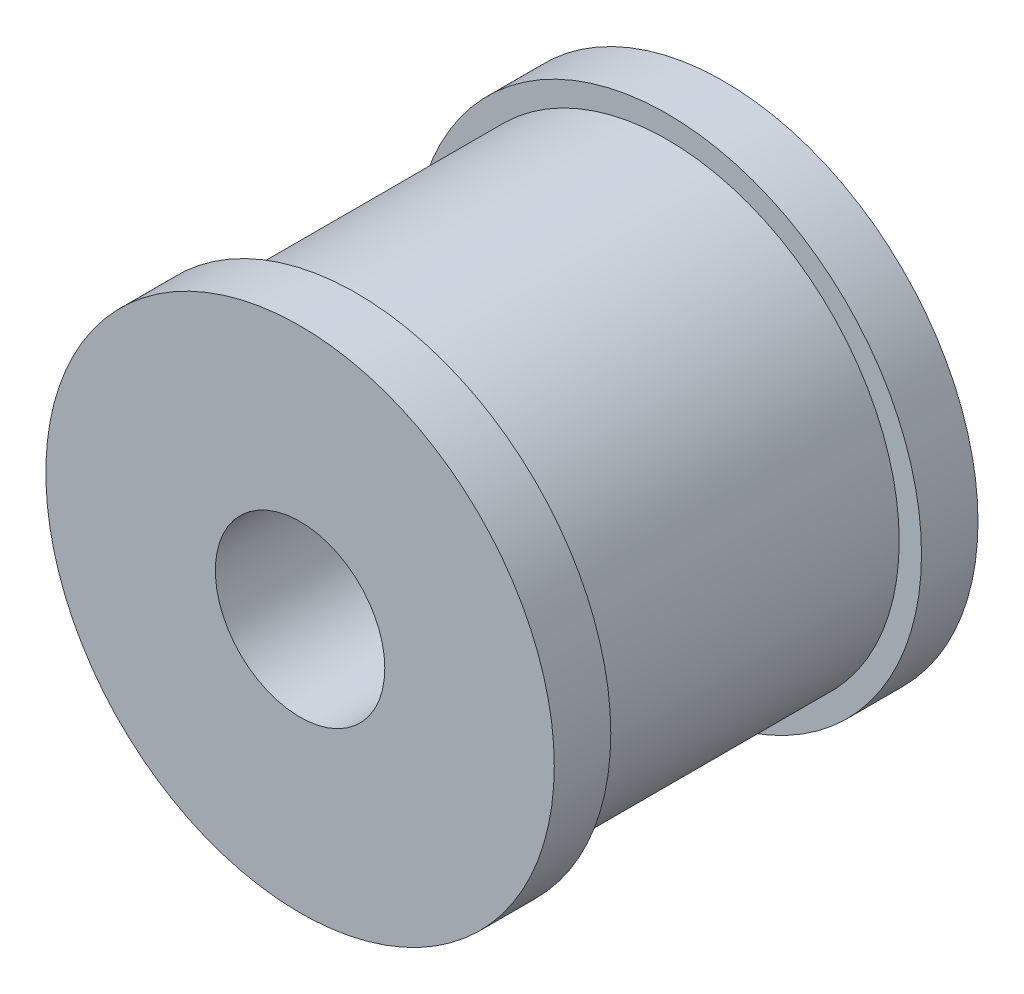
from build123d import *

# Parameters (mm, degrees)
SKETCH_1_R               = 9
SKETCH_1_R_2             = 3
EXTRUDE_1_DEPTH          = 15
CUT_EXTRUDE_1_DEPTH      = 5.5
CUT_EXTRUDE_1_DEPTH_BACK = 5.5
SKETCH_3_R               = 18.21
SKETCH_3_R_2             = 8.21


with BuildPart() as part:
    # 草图1 → 凸台-拉伸1 (new body)
    with BuildSketch(Plane.XY):
        Circle(SKETCH_1_R)
        Circle(SKETCH_1_R_2, mode=Mode.SUBTRACT)
    extrude(amount=EXTRUDE_1_DEPTH)

    # 草图3 → 切除-拉伸-薄壁1 (cut, two sides: drawn at the far end of the back side and taken through both)
    with BuildSketch(Plane.XY.offset(7.5).offset(-CUT_EXTRUDE_1_DEPTH_BACK)):
        Circle(SKETCH_3_R)
        Circle(SKETCH_3_R_2, mode=Mode.SUBTRACT)
    extrude(amount=CUT_EXTRUDE_1_DEPTH + CUT_EXTRUDE_1_DEPTH_BACK, mode=Mode.SUBTRACT)


solid = part.part
